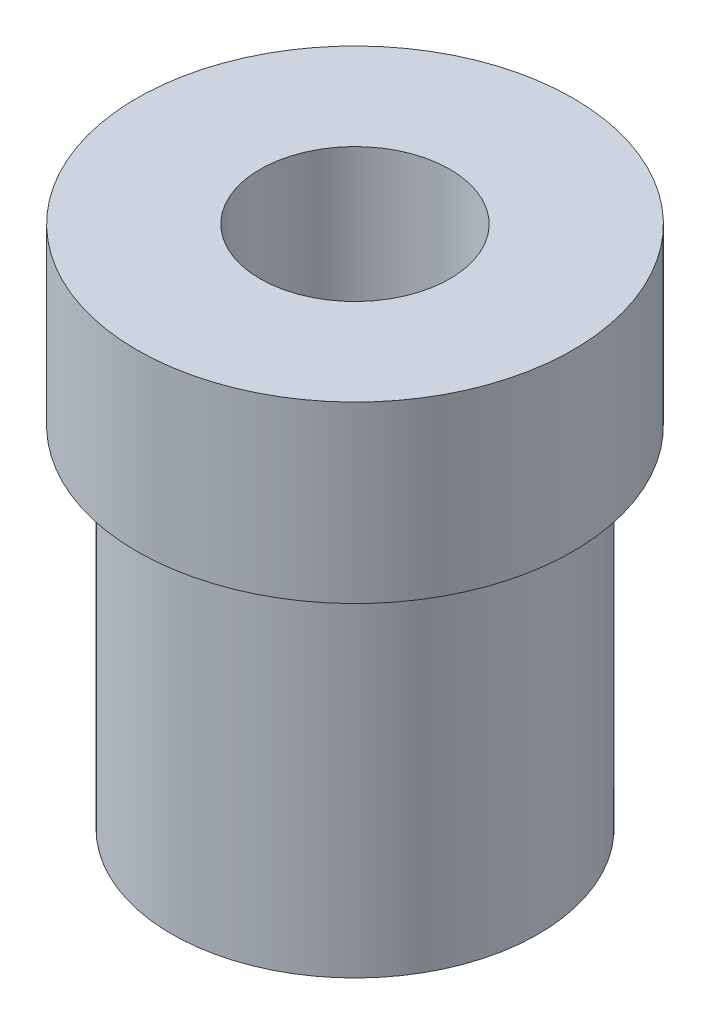
from build123d import *

# Parameters (mm, degrees)
SKETCH1_R               = 7.9375
BOSS_EXTRUDE1_DEPTH     = 6.35
SKETCH2_R               = 6.6675
BOSS_EXTRUDE2_DEPTH     = 12.7
CUT_EXTRUDE1_DEPTH      = 23.11131639
CUT_EXTRUDE1_DEPTH_BACK = 23.11131639
SKETCH5_R               = 3.4544


with BuildPart() as part:
    # Sketch1 → Boss-Extrude1 (new body)
    with BuildSketch(Plane(origin=(0, 0, 0), x_dir=(1, 0, 0), z_dir=(0, 1, 0))):
        with Locations(Location((0, 0, 0), (0, 0, 270))):
            Circle(SKETCH1_R)
    extrude(amount=BOSS_EXTRUDE1_DEPTH)

    # Sketch2 → Boss-Extrude2 (add)
    with BuildSketch(Plane.XZ):
        with Locations(Location((0, 0, 0), (0, 0, 270))):
            Circle(SKETCH2_R)
    extrude(amount=BOSS_EXTRUDE2_DEPTH)

    # Sketch5 → Cut-Extrude1 (cut, two sides: drawn at the far end of the back side and taken through both)
    with BuildSketch(Plane(origin=(0, 6.35, 0), x_dir=(1, 0, 0), z_dir=(0, 1, 0)).offset(-CUT_EXTRUDE1_DEPTH_BACK)):
        with Locations(Location((0, 0, 0), (0, 0, 270))):
            Circle(SKETCH5_R)
    extrude(amount=CUT_EXTRUDE1_DEPTH + CUT_EXTRUDE1_DEPTH_BACK, mode=Mode.SUBTRACT)


solid = part.part
